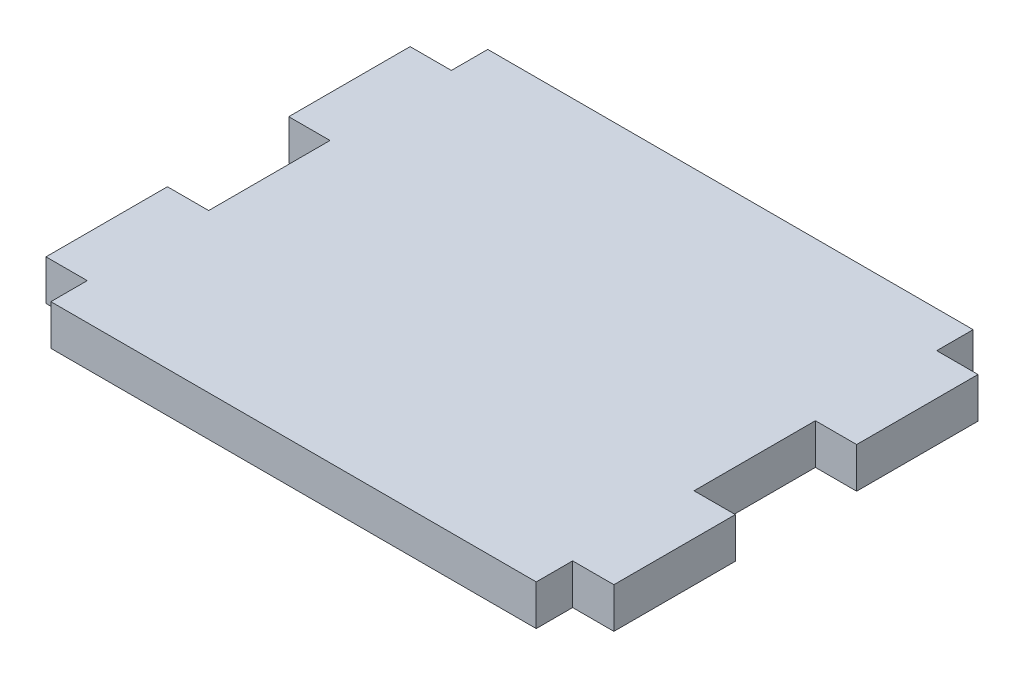
from build123d import *

# Parameters (mm, degrees)
SKETCH1_W           = 54.009051094
SKETCH1_H           = 5
BOSS_EXTRUDE1_DEPTH = 70.2
SKETCH5_W           = 5.1
SKETCH5_H           = 4.5
SKETCH5_H_2         = 15
CUT_EXTRUDE1_DEPTH  = 76.380928623


with BuildPart() as part:
    # Sketch1 → Boss-Extrude1 (new body)
    with BuildSketch(Plane(origin=(0, 0, 0), x_dir=(0, 0, -1), z_dir=(1, 0, 0))):
        Rectangle(SKETCH1_W, SKETCH1_H)
    extrude(amount=BOSS_EXTRUDE1_DEPTH)

    # Sketch5 → Cut-Extrude1 (cut, through all)
    with BuildSketch(Plane.XZ.offset(2.5)):
        with Locations((67.65, 24.754525547)):
            Rectangle(SKETCH5_W, SKETCH5_H)
        with Locations((67.65, -24.754525547)):
            Rectangle(SKETCH5_W, SKETCH5_H)
        with Locations((67.65, -0.004525547)):
            Rectangle(SKETCH5_W, SKETCH5_H_2)
        with Locations((2.55, -24.754525547)):
            Rectangle(SKETCH5_W, SKETCH5_H)
        with Locations((2.55, -0.004525547)):
            Rectangle(SKETCH5_W, SKETCH5_H_2)
        with Locations((2.55, 24.754525547)):
            Rectangle(SKETCH5_W, SKETCH5_H)
    extrude(amount=-CUT_EXTRUDE1_DEPTH, mode=Mode.SUBTRACT)


solid = part.part
